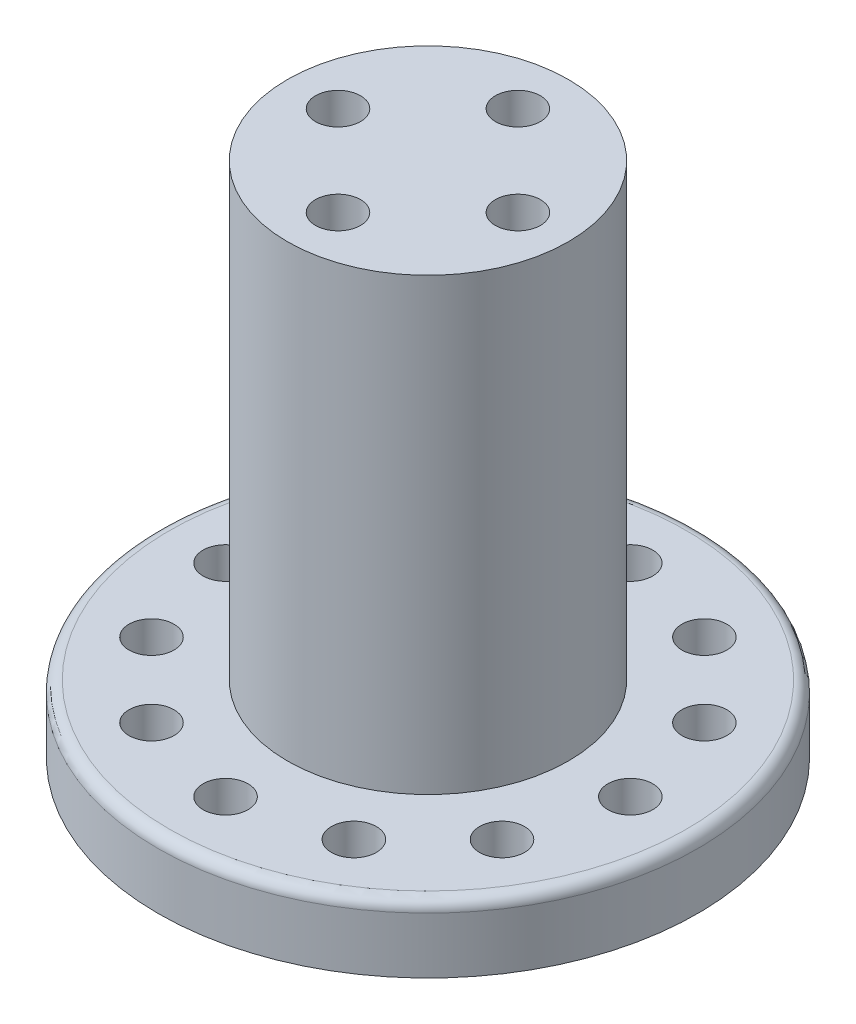
from build123d import *

# Parameters (mm, degrees)
SKETCH1_R           = 24
BOSS_EXTRUDE1_DEPTH = 6
SKETCH2_R           = 2
CUT_EXTRUDE1_DEPTH  = 4
SKETCH3_R           = 1.25
CUT_EXTRUDE2_DEPTH  = 35.176014981
SKETCH4_R           = 12.5
BOSS_EXTRUDE2_DEPTH = 40
SKETCH5_R           = 8.5
CUT_EXTRUDE3_DEPTH  = 5
FILLET1_R           = 1
SKETCH6_R           = 2
CUT_EXTRUDE4_DEPTH  = 20


with BuildPart() as part:
    # Sketch1 → Boss-Extrude1 (new body)
    with BuildSketch(Plane(origin=(0, 0, 0), x_dir=(1, 0, 0), z_dir=(0, 1, 0))):
        with Locations(Location((0, 0, 0), (0, 0, 270))):
            Circle(SKETCH1_R)
    extrude(amount=BOSS_EXTRUDE1_DEPTH)

    # Sketch2 → Cut-Extrude1 (cut)
    with BuildSketch(Plane(origin=(0, 6, 0), x_dir=(1, 0, 0), z_dir=(0, 1, 0))):
        with Locations(Location((0, 18, 0), (0, 0, 270))):
            Circle(SKETCH2_R)
        with Locations(Location((9, 15.588457268, 0), (0, 0, 270))):
            Circle(SKETCH2_R)
        with Locations(Location((15.588457268, 9, 0), (0, 0, 270))):
            Circle(SKETCH2_R)
        with Locations(Location((18, 0, 0), (0, 0, 270))):
            Circle(SKETCH2_R)
        with Locations(Location((15.588457268, -9, 0), (0, 0, 270))):
            Circle(SKETCH2_R)
        with Locations(Location((9, -15.588457268, 0), (0, 0, 270))):
            Circle(SKETCH2_R)
        with Locations(Location((0, -18, 0), (0, 0, 270))):
            Circle(SKETCH2_R)
        with Locations(Location((-9, -15.588457268, 0), (0, 0, 270))):
            Circle(SKETCH2_R)
        with Locations(Location((-15.588457268, -9, 0), (0, 0, 270))):
            Circle(SKETCH2_R)
        with Locations(Location((-18, 0, 0), (0, 0, 270))):
            Circle(SKETCH2_R)
        with Locations(Location((-15.588457268, 9, 0), (0, 0, 270))):
            Circle(SKETCH2_R)
        with Locations(Location((-9, 15.588457268, 0), (0, 0, 270))):
            Circle(SKETCH2_R)
    extrude(amount=-CUT_EXTRUDE1_DEPTH, mode=Mode.SUBTRACT)

    # Sketch3 → Cut-Extrude2 (cut, through all)
    with BuildSketch(Plane(origin=(0, 2, 0), x_dir=(1, 0, 0), z_dir=(0, 1, 0))):
        with Locations(Location((0, 18, 0), (0, 0, 270))):
            Circle(SKETCH3_R)
        with Locations(Location((9, 15.588457268, 0), (0, 0, 270))):
            Circle(SKETCH3_R)
        with Locations(Location((15.588457268, 9, 0), (0, 0, 270))):
            Circle(SKETCH3_R)
        with Locations(Location((18, 0, 0), (0, 0, 270))):
            Circle(SKETCH3_R)
        with Locations(Location((15.588457268, -9, 0), (0, 0, 270))):
            Circle(SKETCH3_R)
        with Locations(Location((9, -15.588457268, 0), (0, 0, 270))):
            Circle(SKETCH3_R)
        with Locations(Location((0, -18, 0), (0, 0, 270))):
            Circle(SKETCH3_R)
        with Locations(Location((-9, -15.588457268, 0), (0, 0, 270))):
            Circle(SKETCH3_R)
        with Locations(Location((-15.588457268, -9, 0), (0, 0, 270))):
            Circle(SKETCH3_R)
        with Locations(Location((-18, 0, 0), (0, 0, 270))):
            Circle(SKETCH3_R)
        with Locations(Location((-15.588457268, 9, 0), (0, 0, 270))):
            Circle(SKETCH3_R)
        with Locations(Location((-9, 15.588457268, 0), (0, 0, 270))):
            Circle(SKETCH3_R)
    extrude(amount=-CUT_EXTRUDE2_DEPTH, mode=Mode.SUBTRACT)

    # Sketch4 → Boss-Extrude2 (add)
    with BuildSketch(Plane(origin=(0, 6, 0), x_dir=(1, 0, 0), z_dir=(0, 1, 0))):
        with Locations(Location((0, 0, 0), (0, 0, 270))):
            Circle(SKETCH4_R)
    extrude(amount=BOSS_EXTRUDE2_DEPTH)

    # Sketch5 → Cut-Extrude3 (cut)
    with BuildSketch(Plane.XZ):
        with Locations(Location((0, 0, 0), (0, 0, 270))):
            Circle(SKETCH5_R)
    extrude(amount=-CUT_EXTRUDE3_DEPTH, mode=Mode.SUBTRACT)

    # Fillet1
    fillet1_edges = [part.edges().sort_by_distance(p)[0] for p in [
        (0, 6, -24),
    ]]
    fillet(fillet1_edges, radius=FILLET1_R)

    # Sketch6 → Cut-Extrude4 (cut)
    with BuildSketch(Plane(origin=(0, 46, 0), x_dir=(1, 0, 0), z_dir=(0, 1, 0))):
        with Locations(Location((0, 8, 0), (0, 0, 270))):
            Circle(SKETCH6_R)
        with Locations(Location((8, 0, 0), (0, 0, 270))):
            Circle(SKETCH6_R)
        with Locations(Location((0, -8, 0), (0, 0, 270))):
            Circle(SKETCH6_R)
        with Locations(Location((-8, 0, 0), (0, 0, 270))):
            Circle(SKETCH6_R)
    extrude(amount=-CUT_EXTRUDE4_DEPTH, mode=Mode.SUBTRACT)


solid = part.part
